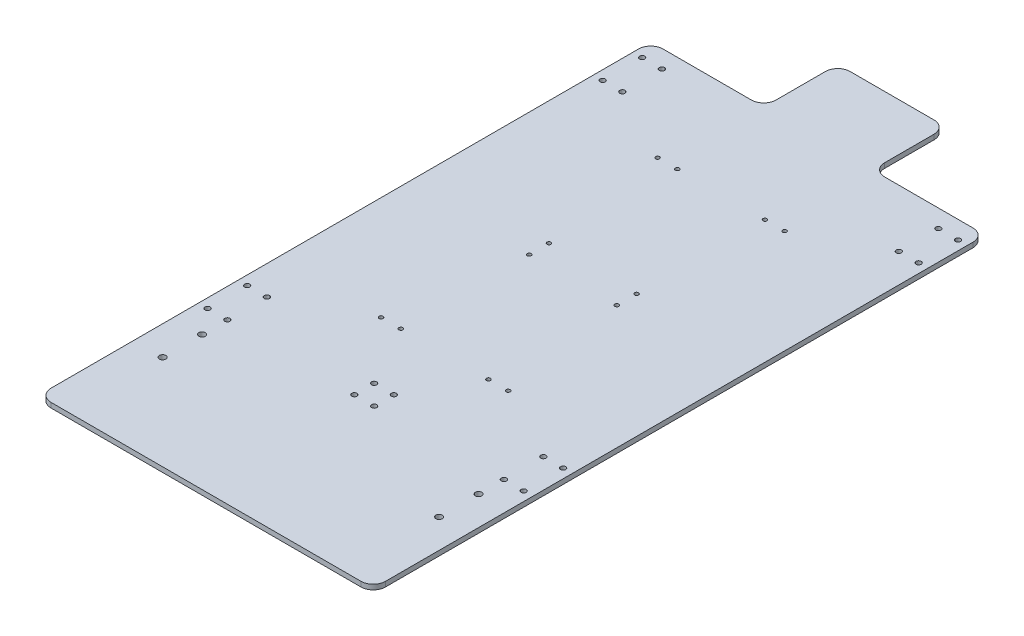
from build123d import *

# Parameters (mm, degrees)
SKETCH_1_W          = 271
SKETCH_1_H          = 420.5
EXTRUDE_1_DEPTH     = 4
SKETCH_2_R          = 2.1
CUT_EXTRUDE_1_DEPTH = 251.162572141
EXTRUDE_2_DEPTH     = 4
FILLET_2_R          = 10
SKETCH_7_R          = 1.6
CUT_EXTRUDE_4_DEPTH = 261.756231949
SKETCH_8_W          = 88
SKETCH_8_H          = 60
EXTRUDE_3_DEPTH     = 4
FILLET_3_R          = 10
SKETCH_9_R          = 2.1
CUT_EXTRUDE_5_DEPTH = 303.34303779
SKETCH_10_R         = 2.6
CUT_EXTRUDE_6_DEPTH = 4
SKETCH_12_W         = 271
SKETCH_12_H         = 62.828427
EXTRUDE_4_DEPTH     = 4
FILLET_4_R          = 10


with BuildPart() as part:
    # 草图1 → 凸台-拉伸1 (new body)
    with BuildSketch(Plane(origin=(0, 0, 0), x_dir=(1, 0, 0), z_dir=(0, 1, 0))):
        Rectangle(SKETCH_1_W, SKETCH_1_H)
    extrude(amount=EXTRUDE_1_DEPTH)

    # 草图2 → 切除-拉伸1 (cut, through all)
    with BuildSketch(Plane(origin=(0, 4, 0), x_dir=(1, 0, 0), z_dir=(0, 1, 0))):
        with Locations(Location((112, 195.75, 0), (0, 0, 270))):
            Circle(SKETCH_2_R)
        with Locations(Location((128, 195.75, 0), (0, 0, 270))):
            Circle(SKETCH_2_R)
        with Locations(Location((112, 163.75, 0), (0, 0, 270))):
            Circle(SKETCH_2_R)
        with Locations(Location((128, 163.75, 0), (0, 0, 270))):
            Circle(SKETCH_2_R)
        with Locations(Location((-128, 163.75, 0), (0, 0, 90))):
            Circle(SKETCH_2_R)
        with Locations(Location((-112, 163.75, 0), (0, 0, 90))):
            Circle(SKETCH_2_R)
        with Locations(Location((-128, 195.75, 0), (0, 0, 90))):
            Circle(SKETCH_2_R)
        with Locations(Location((-112, 195.75, 0), (0, 0, 90))):
            Circle(SKETCH_2_R)
        with Locations(Location((128, -124.25, 0), (0, 0, 270))):
            Circle(SKETCH_2_R)
        with Locations(Location((112, -124.25, 0), (0, 0, 270))):
            Circle(SKETCH_2_R)
        with Locations(Location((128, -156.25, 0), (0, 0, 270))):
            Circle(SKETCH_2_R)
        with Locations(Location((112, -156.25, 0), (0, 0, 270))):
            Circle(SKETCH_2_R)
        with Locations(Location((-112, -156.25, 0), (0, 0, 90))):
            Circle(SKETCH_2_R)
        with Locations(Location((-128, -156.25, 0), (0, 0, 90))):
            Circle(SKETCH_2_R)
        with Locations(Location((-112, -124.25, 0), (0, 0, 90))):
            Circle(SKETCH_2_R)
        with Locations(Location((-128, -124.25, 0), (0, 0, 90))):
            Circle(SKETCH_2_R)
    extrude(amount=-CUT_EXTRUDE_1_DEPTH, mode=Mode.SUBTRACT)

    # 草图3 → 凸台-拉伸2 (add)
    with BuildSketch(Plane(origin=(0, 4, 0), x_dir=(1, 0, 0), z_dir=(0, 1, 0))):
        Polygon((-135.5, -215), (-135.5, -210.25), (135.5, -210.25), (135.5, -215), (135.5, -222.75), (102, -222.75), (-102, -222.75), (-135.5, -222.75), align=None)
    extrude(amount=-EXTRUDE_2_DEPTH)

    # 圆角2
    fillet_2_edges = [part.edges().sort_by_distance(p)[0] for p in [
        (-135.5, 2, -210.25),
        (135.5, 2, -210.25),
    ]]
    fillet(fillet_2_edges, radius=FILLET_2_R)

    # 草图7 → 切除-拉伸4 (cut, through all)
    with BuildSketch(Plane.XZ):
        with Locations(Location((-51.5, -131.75, 0), (0, 0, 270))):
            Circle(SKETCH_7_R)
        with Locations(Location((-35.5, -131.75, 0), (0, 0, 270))):
            Circle(SKETCH_7_R)
        with Locations(Location((35.5, -131.75, 0), (0, 0, 90))):
            Circle(SKETCH_7_R)
        with Locations(Location((51.5, -131.75, 0), (0, 0, 90))):
            Circle(SKETCH_7_R)
        with Locations(Location((-51.5, 92.25, 0), (0, 0, 270))):
            Circle(SKETCH_7_R)
        with Locations(Location((-35.5, 92.25, 0), (0, 0, 270))):
            Circle(SKETCH_7_R)
        with Locations(Location((35.5, 92.25, 0), (0, 0, 90))):
            Circle(SKETCH_7_R)
        with Locations(Location((51.5, 92.25, 0), (0, 0, 90))):
            Circle(SKETCH_7_R)
        with Locations(Location((-35.5, -27.75, 0), (0, 0, 270))):
            Circle(SKETCH_7_R)
        with Locations(Location((-35.5, -11.75, 0), (0, 0, 270))):
            Circle(SKETCH_7_R)
        with Locations(Location((35.5, -11.75, 0), (0, 0, 90))):
            Circle(SKETCH_7_R)
        with Locations(Location((35.5, -27.75, 0), (0, 0, 90))):
            Circle(SKETCH_7_R)
    extrude(amount=-CUT_EXTRUDE_4_DEPTH, mode=Mode.SUBTRACT)

    # 草图8 → 凸台-拉伸3 (add)
    with BuildSketch(Plane.XZ):
        with Locations((0, -240.25)):
            Rectangle(SKETCH_8_W, SKETCH_8_H)
    extrude(amount=-EXTRUDE_3_DEPTH)

    # 圆角3
    fillet_3_edges = [part.edges().sort_by_distance(p)[0] for p in [
        (44, 2, -270.25),
        (-44, 2, -270.25),
    ]]
    fillet(fillet_3_edges, radius=FILLET_3_R)

    # 草图9 → 切除-拉伸5 (cut, through all)
    with BuildSketch(Plane.XZ):
        with Locations(Location((-8, 157.35, 0), (0, 0, 270))):
            Circle(SKETCH_9_R)
        with Locations(Location((8, 157.35, 0), (0, 0, 270))):
            Circle(SKETCH_9_R)
        with Locations(Location((-8, 141.35, 0), (0, 0, 270))):
            Circle(SKETCH_9_R)
        with Locations(Location((8, 141.35, 0), (0, 0, 270))):
            Circle(SKETCH_9_R)
    extrude(amount=-CUT_EXTRUDE_5_DEPTH, mode=Mode.SUBTRACT)

    # 草图10 → 切除-拉伸6 (cut)
    with BuildSketch(Plane.XZ):
        with Locations(Location((-112, 208.75, 0), (0, 0, 270))):
            Circle(SKETCH_10_R)
        with Locations(Location((-112, 176.75, 0), (0, 0, 270))):
            Circle(SKETCH_10_R)
        with Locations(Location((112, 176.75, 0), (0, 0, 90))):
            Circle(SKETCH_10_R)
        with Locations(Location((112, 208.75, 0), (0, 0, 90))):
            Circle(SKETCH_10_R)
    extrude(amount=-CUT_EXTRUDE_6_DEPTH, mode=Mode.SUBTRACT)

    # 草图12 → 凸台-拉伸4 (add)
    with BuildSketch(Plane.XZ):
        with Locations((0, 254.1642135)):
            Rectangle(SKETCH_12_W, SKETCH_12_H)
    extrude(amount=-EXTRUDE_4_DEPTH)

    # 圆角4
    fillet_4_edges = [part.edges().sort_by_distance(p)[0] for p in [
        (44, 2, -210.25),
        (-44, 2, -210.25),
        (135.5, 2, 285.578427),
        (-135.5, 2, 285.578427),
    ]]
    fillet(fillet_4_edges, radius=FILLET_4_R)


solid = part.part
